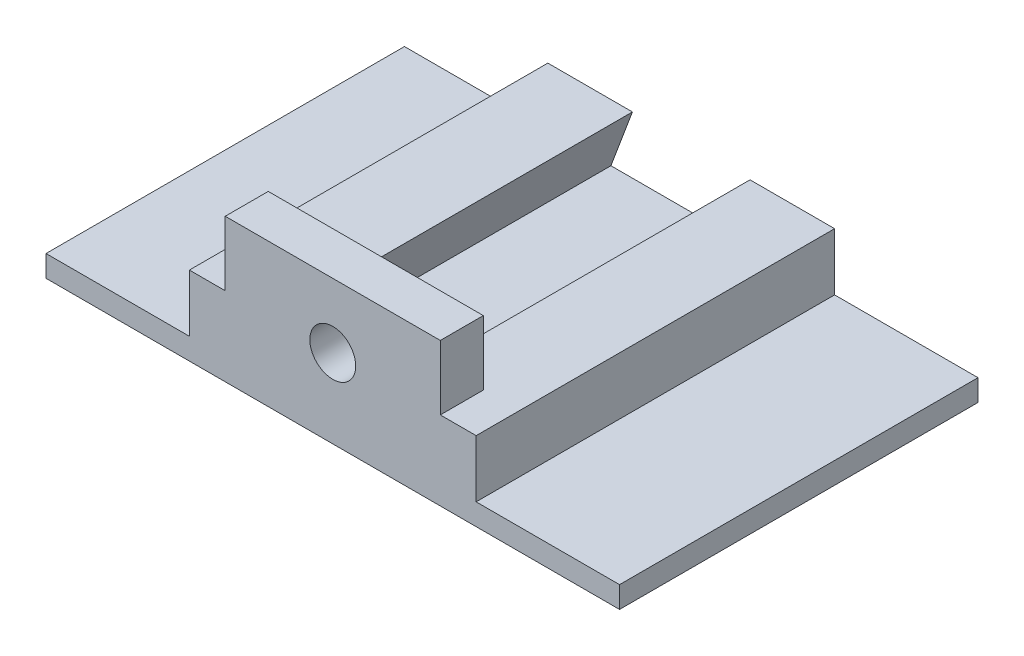
from build123d import *

# Parameters (mm, degrees)
SALIENTE_EXTRUIR1_DEPTH = 25
CROQUIS2_W              = 15
CROQUIS2_H              = 10
CROQUIS2_R              = 1.6
SALIENTE_EXTRUIR2_DEPTH = 3
CROQUIS3_W              = 10
CROQUIS3_H              = 4
CORTAR_EXTRUIR1_DEPTH   = 33


with BuildPart() as part:
    # Croquis1 → Saliente-Extruir1 (new body)
    with BuildSketch(Plane.XY):
        Polygon((15.9, 5.5), (14.4, 1.5), (25.6, 1.5), (24.1, 5.5), (40, 5.5), (40, 0), (0, 0), (0, 5.5), align=None)
    extrude(amount=SALIENTE_EXTRUIR1_DEPTH)

    # Croquis2 → Saliente-Extruir2 (add)
    with BuildSketch(Plane.XY.offset(25)):
        with Locations((20, 5)):
            Rectangle(CROQUIS2_W, CROQUIS2_H)
        with Locations((20, 5.5)):
            Circle(CROQUIS2_R, mode=Mode.SUBTRACT)
    extrude(amount=-SALIENTE_EXTRUIR2_DEPTH)

    # Croquis3 → Cortar-Extruir1 (cut)
    with BuildSketch(Plane.XY.offset(25)):
        with Locations((5, 3.5)):
            Rectangle(CROQUIS3_W, CROQUIS3_H)
        with Locations((35, 3.5)):
            Rectangle(CROQUIS3_W, CROQUIS3_H)
    extrude(amount=-CORTAR_EXTRUIR1_DEPTH, mode=Mode.SUBTRACT)


solid = part.part
